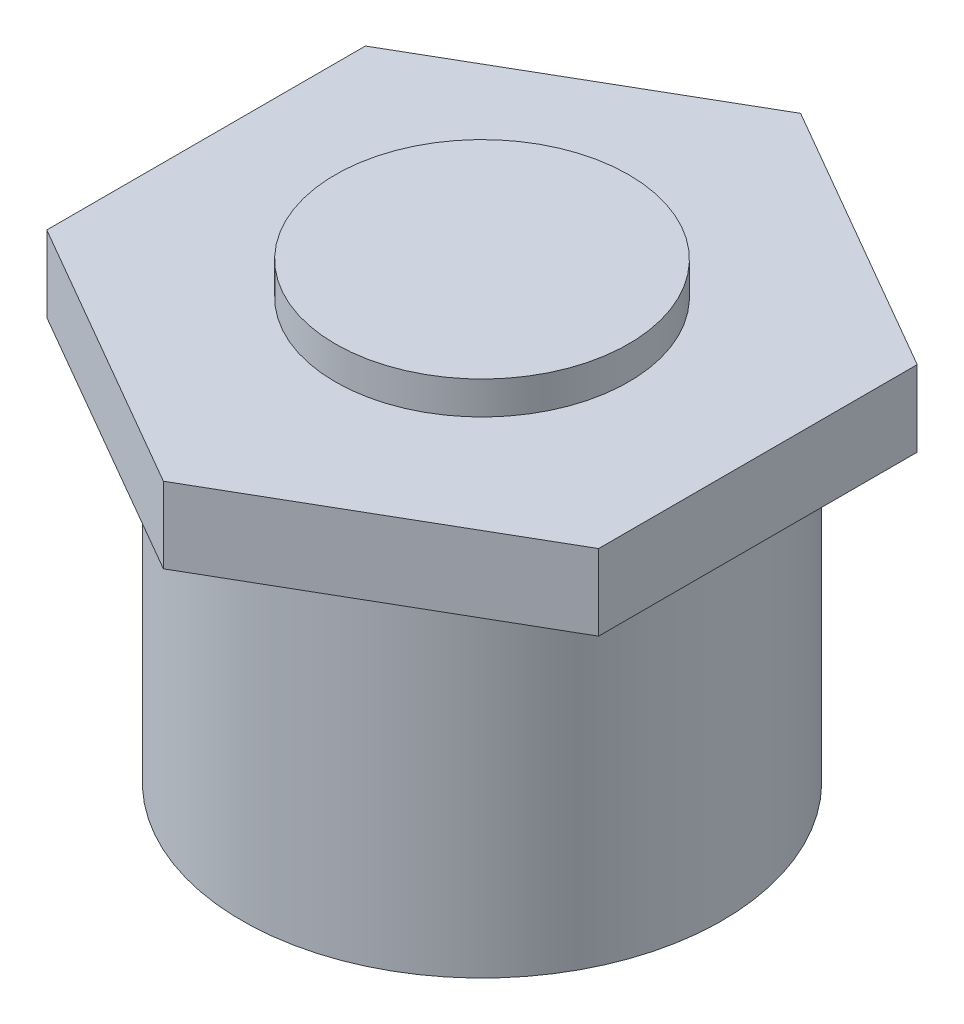
from build123d import *

# Parameters (mm, degrees)
EXTRUDE_1_DEPTH = 3
SKETCH_2_R      = 9.5
EXTRUDE_2_DEPTH = 13.6
SKETCH_3_R      = 5.8
EXTRUDE_3_DEPTH = 1.3


with BuildPart() as part:
    # 草图1 → 凸台-拉伸1 (new body)
    with BuildSketch(Plane(origin=(0, 0, 0), x_dir=(1, 0, 0), z_dir=(0, 1, 0))):
        Polygon((0, 12.6), (-10.911920088, 6.3), (-10.911920088, -6.3), (0, -12.6), (10.911920088, -6.3), (10.911920088, 6.3), align=None)
    extrude(amount=EXTRUDE_1_DEPTH)

    # 草图2 → 凸台-拉伸2 (add)
    with BuildSketch(Plane.XZ):
        with Locations(Location((0, 0, 0), (0, 0, 270))):
            Circle(SKETCH_2_R)
    extrude(amount=EXTRUDE_2_DEPTH)

    # 草图3 → 凸台-拉伸3 (add)
    with BuildSketch(Plane(origin=(0, 3, 0), x_dir=(1, 0, 0), z_dir=(0, 1, 0))):
        with Locations(Location((0, 0, 0), (0, 0, 270))):
            Circle(SKETCH_3_R)
    extrude(amount=EXTRUDE_3_DEPTH)


solid = part.part
